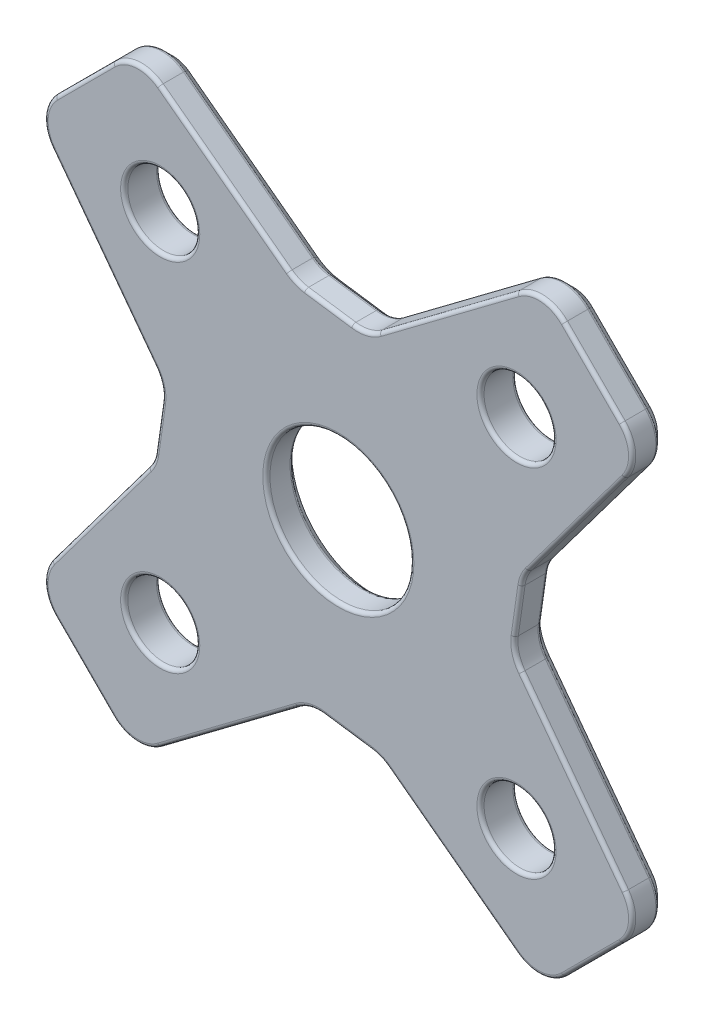
from build123d import *
from OCP.BRepFilletAPI import BRepFilletAPI_MakeChamfer

# Parameters (mm, degrees)
BOSS_EXTRUDE1_DEPTH = 10
CHAMFER1_SIZE       = 10
CHAMFER1_SIZE2      = 14.705882353
FILLET1_R           = 10
FILLET3_R           = 10
CHAMFER5_SIZE       = 3
FILLET4_R           = 1
FILLET5_R           = 1
FILLET6_R           = 1
CHAMFER6_SIZE       = 3
FILLET8_R           = 1
FILLET9_R           = 1
FILLET10_R          = 1


with BuildPart() as part:
    # Sketch1 → Boss-Extrude1 (new body)
    with BuildSketch(Plane.XY):
        with BuildLine():
            Line((-56.568542495, 84.852813742), (-70.710678119, 70.710678119))
            Line((-70.710678119, 70.710678119), (-56.568542495, 56.568542495))
            ThreePointArc((-56.568542495, 56.568542495), (-45.670640359, 58.736270008), (-39.497474683, 49.497474683))
            ThreePointArc((-39.497474683, 49.497474683), (-40.258679358, 45.670640359), (-42.426406871, 42.426406871))
            Line((-42.426406871, 42.426406871), (-14.142135624, 14.142135624))
            ThreePointArc((-14.142135624, 14.142135624), (0, 20), (14.142135624, 14.142135624))
            Line((14.142135624, 14.142135624), (42.426406871, 42.426406871))
            ThreePointArc((42.426406871, 42.426406871), (42.426406871, 56.568542495), (56.568542495, 56.568542495))
            Line((56.568542495, 56.568542495), (70.710678119, 70.710678119))
            Line((70.710678119, 70.710678119), (56.568542495, 84.852813742))
            Line((56.568542495, 84.852813742), (0, 42.426406871))
            Line((0, 42.426406871), (-56.568542495, 84.852813742))
        make_face()
        with BuildLine():
            Line((-42.426406871, 0), (-84.852813742, -56.568542495))
            Line((-84.852813742, -56.568542495), (-70.710678119, -70.710678119))
            Line((-70.710678119, -70.710678119), (-56.568542495, -56.568542495))
            ThreePointArc((-56.568542495, -56.568542495), (-56.568542495, -42.426406871), (-42.426406871, -42.426406871))
            Line((-42.426406871, -42.426406871), (-14.142135624, -14.142135624))
            ThreePointArc((-14.142135624, -14.142135624), (-20, 0), (-14.142135624, 14.142135624))
            Line((-14.142135624, 14.142135624), (-42.426406871, 42.426406871))
            ThreePointArc((-42.426406871, 42.426406871), (-56.568542495, 42.426406871), (-56.568542495, 56.568542495))
            Line((-56.568542495, 56.568542495), (-70.710678119, 70.710678119))
            Line((-70.710678119, 70.710678119), (-84.852813742, 56.568542495))
            Line((-84.852813742, 56.568542495), (-42.426406871, 0))
        make_face()
        with BuildLine():
            Line((-56.568542495, -56.568542495), (-70.710678119, -70.710678119))
            Line((-70.710678119, -70.710678119), (-56.568542495, -84.852813742))
            Line((-56.568542495, -84.852813742), (0, -42.426406871))
            Line((0, -42.426406871), (56.568542495, -84.852813742))
            Line((56.568542495, -84.852813742), (70.710678119, -70.710678119))
            Line((70.710678119, -70.710678119), (56.568542495, -56.568542495))
            ThreePointArc((56.568542495, -56.568542495), (42.426406871, -56.568542495), (42.426406871, -42.426406871))
            Line((42.426406871, -42.426406871), (14.142135624, -14.142135624))
            ThreePointArc((14.142135624, -14.142135624), (0, -20), (-14.142135624, -14.142135624))
            Line((-14.142135624, -14.142135624), (-42.426406871, -42.426406871))
            ThreePointArc((-42.426406871, -42.426406871), (-40.258679358, -45.670640359), (-39.497474683, -49.497474683))
            ThreePointArc((-39.497474683, -49.497474683), (-45.670640359, -58.736270008), (-56.568542495, -56.568542495))
        make_face()
        with BuildLine():
            Line((56.568542495, -56.568542495), (70.710678119, -70.710678119))
            Line((70.710678119, -70.710678119), (84.852813742, -56.568542495))
            Line((84.852813742, -56.568542495), (42.426406871, 0))
            Line((42.426406871, 0), (84.852813742, 56.568542495))
            Line((84.852813742, 56.568542495), (70.710678119, 70.710678119))
            Line((70.710678119, 70.710678119), (56.568542495, 56.568542495))
            ThreePointArc((56.568542495, 56.568542495), (58.736270008, 53.324309007), (59.497474683, 49.497474683))
            ThreePointArc((59.497474683, 49.497474683), (53.324309007, 40.258679358), (42.426406871, 42.426406871))
            Line((42.426406871, 42.426406871), (14.142135624, 14.142135624))
            ThreePointArc((14.142135624, 14.142135624), (18.47759065, 7.653668647), (20, 0))
            ThreePointArc((20, 0), (18.47759065, -7.653668647), (14.142135624, -14.142135624))
            Line((14.142135624, -14.142135624), (42.426406871, -42.426406871))
            ThreePointArc((42.426406871, -42.426406871), (53.324309007, -40.258679358), (59.497474683, -49.497474683))
            ThreePointArc((59.497474683, -49.497474683), (58.736270008, -53.324309007), (56.568542495, -56.568542495))
        make_face()
    extrude(amount=BOSS_EXTRUDE1_DEPTH)

    # Chamfer1: one chamfer whose edges measure the first distance from different faces: ONE call of the kernel's chamfer builder (chamfer() names one face for all edges)
    chamfer1_edges_1 = [part.edges().sort_by_distance(p)[0] for p in [
        (0, -42.426406871, 5),
    ]]
    chamfer1_side_1 = [part.faces().sort_by_distance(p)[0] for p in [
        (-28.284271247, -63.639610307, 5),
    ]]
    chamfer1_edges_2 = [part.edges().sort_by_distance(p)[0] for p in [
        (-42.426406871, 0, 5),
    ]]
    chamfer1_side_2 = [part.faces().sort_by_distance(p)[0] for p in [
        (-63.639610307, 28.284271247, 5),
    ]]
    chamfer1_edges_3 = [part.edges().sort_by_distance(p)[0] for p in [
        (0, 42.426406871, 5),
    ]]
    chamfer1_side_3 = [part.faces().sort_by_distance(p)[0] for p in [
        (28.284271247, 63.639610307, 5),
    ]]
    chamfer1_edges_4 = [part.edges().sort_by_distance(p)[0] for p in [
        (42.426406871, 0, 5),
    ]]
    chamfer1_side_4 = [part.faces().sort_by_distance(p)[0] for p in [
        (63.639610307, -28.284271247, 5),
    ]]
    chamfer1 = BRepFilletAPI_MakeChamfer(part.part.solid().wrapped)
    for e in chamfer1_edges_1:
        chamfer1.Add(CHAMFER1_SIZE, CHAMFER1_SIZE2, e.wrapped, chamfer1_side_1[0].wrapped)  # the first distance lies on this face
    for e in chamfer1_edges_2:
        chamfer1.Add(CHAMFER1_SIZE, CHAMFER1_SIZE2, e.wrapped, chamfer1_side_2[0].wrapped)  # the first distance lies on this face
    for e in chamfer1_edges_3:
        chamfer1.Add(CHAMFER1_SIZE, CHAMFER1_SIZE2, e.wrapped, chamfer1_side_3[0].wrapped)  # the first distance lies on this face
    for e in chamfer1_edges_4:
        chamfer1.Add(CHAMFER1_SIZE, CHAMFER1_SIZE2, e.wrapped, chamfer1_side_4[0].wrapped)  # the first distance lies on this face
    add(Compound.cast(chamfer1.Shape()), mode=Mode.REPLACE)

    # Fillet1
    fillet1_edges = [part.edges().sort_by_distance(p)[0] for p in [
        (11.764705882, -51.249936283, 5),
        (-8, -48.426406871, 5),
        (51.249936283, 11.764705882, 5),
        (48.426406871, -8, 5),
        (-11.764705882, 51.249936283, 5),
        (8, 48.426406871, 5),
        (-51.249936283, -11.764705882, 5),
        (-48.426406871, 8, 5),
    ]]
    fillet(fillet1_edges, radius=FILLET1_R)

    # Fillet3
    fillet3_edges = [part.edges().sort_by_distance(p)[0] for p in [
        (-56.568542495, -84.852813742, 5),
        (-84.852813742, -56.568542495, 5),
        (-84.852813742, 56.568542495, 5),
        (-56.568542495, 84.852813742, 5),
        (56.568542495, 84.852813742, 5),
        (84.852813742, 56.568542495, 5),
        (84.852813742, -56.568542495, 5),
        (56.568542495, -84.852813742, 5),
    ]]
    fillet(fillet3_edges, radius=FILLET3_R)

    # Chamfer5
    chamfer5_edges = [part.edges().sort_by_distance(p)[0] for p in [
        (-2.664497915, 49.949906573, 0),
        (-31.722228243, 66.218078053, 0),
        (-66.218078053, -31.722228243, 0),
        (-49.949906573, -2.664497915, 0),
        (-7.795518235, -49.224551391, 0),
        (11.641111528, -51.548319449, 0),
        (49.224551391, -7.795518235, 0),
        (51.548319449, 11.641111528, 0),
        (7.795518235, 49.224551391, 0),
        (-11.641111528, 51.548319449, 0),
        (-51.548319449, -11.641111528, 0),
        (-49.224551391, 7.795518235, 0),
        (-70.710678119, -70.710678119, 0),
        (-30.47194389, -65.280364789, 0),
        (-65.280364789, 30.47194389, 0),
        (-70.710678119, 70.710678119, 0),
        (30.47194389, 65.280364789, 0),
        (70.710678119, 70.710678119, 0),
        (65.280364789, -30.47194389, 0),
        (70.710678119, -70.710678119, 0),
        (-56.339069482, 81.62388342, 0),
        (-81.62388342, 56.339069482, 0),
        (56.339069482, 81.62388342, 0),
        (81.62388342, 56.339069482, 0),
        (81.62388342, -56.339069482, 0),
        (56.339069482, -81.62388342, 0),
        (-56.339069482, -81.62388342, 0),
        (-81.62388342, -56.339069482, 0),
        (2.664497915, -49.949906573, 0),
        (31.722228243, -66.218078053, 0),
        (49.949906573, 2.664497915, 0),
        (66.218078053, 31.722228243, 0),
    ]]
    chamfer(chamfer5_edges, length=CHAMFER5_SIZE)

    # Fillet4
    fillet4_edges = [part.edges().sort_by_distance(p)[0] for p in [
        (62.880364789, -32.27194389, 0),
        (46.318410335, -8.540061156, 0),
        (78.631430794, -56.126402422, 0),
        (46.980058092, 3.088761984, 0),
        (68.589357775, -68.589357775, 0),
        (48.776680852, 12.789161825, 0),
        (56.126402422, -78.631430794, 0),
        (63.818078053, 33.522228243, 0),
        (33.522228243, -63.818078053, 0),
        (78.631430794, 56.126402422, 0),
        (12.789161825, -48.776680852, 0),
        (68.589357775, 68.589357775, 0),
        (3.088761984, -46.980058092, 0),
        (56.126402422, 78.631430794, 0),
        (-8.540061156, -46.318410335, 0),
        (32.27194389, 62.880364789, 0),
        (-32.27194389, -62.880364789, 0),
        (8.540061156, 46.318410335, 0),
        (-56.126402422, -78.631430794, 0),
        (-3.088761984, 46.980058092, 0),
        (-68.589357775, -68.589357775, 0),
        (-12.789161825, 48.776680852, 0),
        (-78.631430794, -56.126402422, 0),
        (-33.522228243, 63.818078053, 0),
        (-63.818078053, -33.522228243, 0),
        (-56.126402422, 78.631430794, 0),
        (-48.776680852, -12.789161825, 0),
        (-68.589357775, 68.589357775, 0),
        (-46.980058092, -3.088761984, 0),
        (-78.631430794, 56.126402422, 0),
        (-46.318410335, 8.540061156, 0),
        (-62.880364789, 32.27194389, 0),
    ]]
    fillet(fillet4_edges, radius=FILLET4_R)

    # Fillet5
    fillet5_edges = [part.edges().sort_by_distance(p)[0] for p in [
        (-65.280364789, 30.47194389, 3),
        (-49.224551391, 7.795518235, 3),
        (-81.62388342, 56.339069482, 3),
        (-49.949906573, -2.664497915, 3),
        (-70.710678119, 70.710678119, 3),
        (-51.548319449, -11.641111528, 3),
        (-56.339069482, 81.62388342, 3),
        (-66.218078053, -31.722228243, 3),
        (-31.722228243, 66.218078053, 3),
        (-81.62388342, -56.339069482, 3),
        (-11.641111528, 51.548319449, 3),
        (-70.710678119, -70.710678119, 3),
        (-2.664497915, 49.949906573, 3),
        (-56.339069482, -81.62388342, 3),
        (7.795518235, 49.224551391, 3),
        (-30.47194389, -65.280364789, 3),
        (30.47194389, 65.280364789, 3),
        (-7.795518235, -49.224551391, 3),
        (56.339069482, 81.62388342, 3),
        (2.664497915, -49.949906573, 3),
        (70.710678119, 70.710678119, 3),
        (11.641111528, -51.548319449, 3),
        (81.62388342, 56.339069482, 3),
        (31.722228243, -66.218078053, 3),
        (66.218078053, 31.722228243, 3),
        (56.339069482, -81.62388342, 3),
        (51.548319449, 11.641111528, 3),
        (70.710678119, -70.710678119, 3),
        (49.949906573, 2.664497915, 3),
        (81.62388342, -56.339069482, 3),
        (49.224551391, -7.795518235, 3),
        (65.280364789, -30.47194389, 3),
    ]]
    fillet(fillet5_edges, radius=FILLET5_R)

    # Fillet6
    fillet6_edges = [part.edges().sort_by_distance(p)[0] for p in [
        (-42.426406871, -42.426406871, 10),
        (42.426406871, -42.426406871, 10),
        (-14.142135624, -14.142135624, 10),
        (42.426406871, -42.426406871, 0),
        (42.426406871, 42.426406871, 0),
        (-42.426406871, 42.426406871, 0),
        (-42.426406871, -42.426406871, 0),
        (-42.426406871, 42.426406871, 10),
        (42.426406871, 42.426406871, 10),
    ]]
    fillet(fillet6_edges, radius=FILLET6_R)

    # Chamfer6
    chamfer6_edges = [part.edges().sort_by_distance(p)[0] for p in [
        (-14.142135624, -14.142135624, 0),
    ]]
    chamfer(chamfer6_edges, length=CHAMFER6_SIZE)

    # Fillet8
    fillet8_edges = [part.edges().sort_by_distance(p)[0] for p in [
        (-14.142135624, -14.142135624, 3),
    ]]
    fillet(fillet8_edges, radius=FILLET8_R)

    # Fillet9
    fillet9_edges = [part.edges().sort_by_distance(p)[0] for p in [
        (-16.263455967, -16.263455967, 0),
    ]]
    fillet(fillet9_edges, radius=FILLET9_R)

    # Fillet10
    fillet10_edges = [part.edges().sort_by_distance(p)[0] for p in [
        (-2.664497915, 49.949906573, 10),
        (-31.722228243, 66.218078053, 10),
        (-66.218078053, -31.722228243, 10),
        (-49.949906573, -2.664497915, 10),
        (-7.795518235, -49.224551391, 10),
        (11.641111528, -51.548319449, 10),
        (49.224551391, -7.795518235, 10),
        (51.548319449, 11.641111528, 10),
        (7.795518235, 49.224551391, 10),
        (-11.641111528, 51.548319449, 10),
        (-51.548319449, -11.641111528, 10),
        (-49.224551391, 7.795518235, 10),
        (-70.710678119, -70.710678119, 10),
        (-30.47194389, -65.280364789, 10),
        (70.710678119, -70.710678119, 10),
        (65.280364789, -30.47194389, 10),
        (70.710678119, 70.710678119, 10),
        (30.47194389, 65.280364789, 10),
        (-70.710678119, 70.710678119, 10),
        (-65.280364789, 30.47194389, 10),
        (-56.339069482, 81.62388342, 10),
        (-81.62388342, 56.339069482, 10),
        (56.339069482, 81.62388342, 10),
        (81.62388342, 56.339069482, 10),
        (81.62388342, -56.339069482, 10),
        (56.339069482, -81.62388342, 10),
        (-56.339069482, -81.62388342, 10),
        (-81.62388342, -56.339069482, 10),
        (2.664497915, -49.949906573, 10),
        (31.722228243, -66.218078053, 10),
        (49.949906573, 2.664497915, 10),
        (66.218078053, 31.722228243, 10),
    ]]
    fillet(fillet10_edges, radius=FILLET10_R)


solid = part.part
